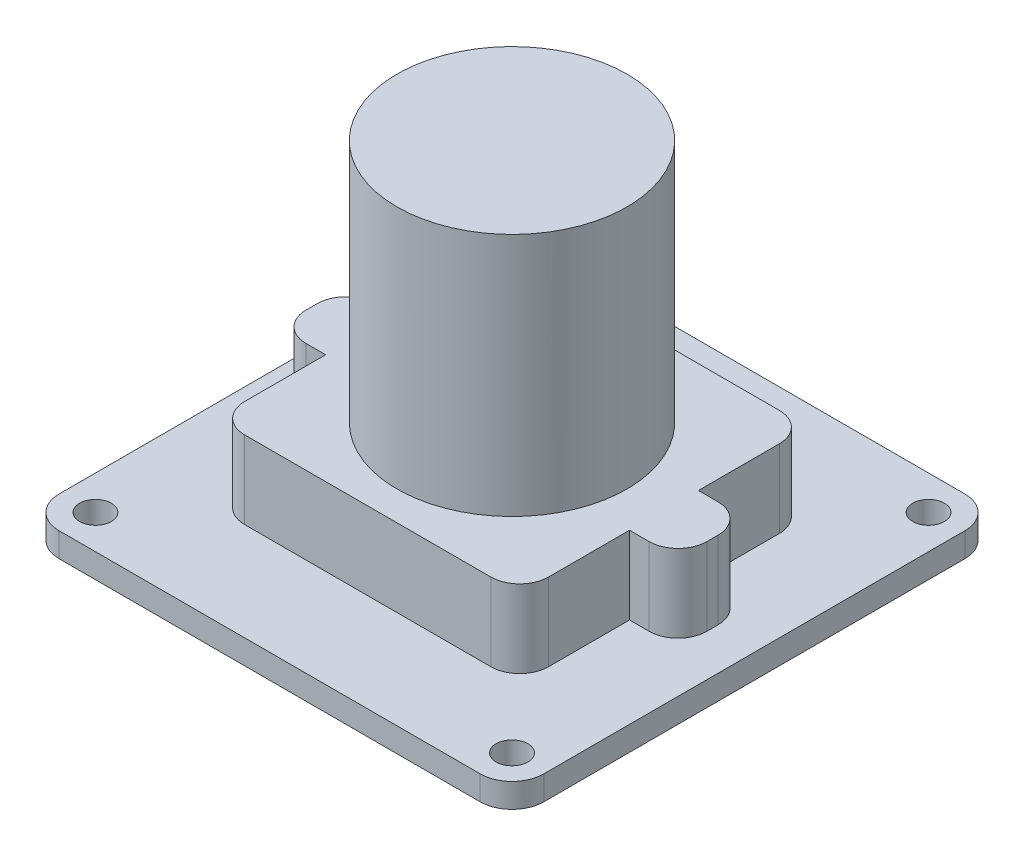
from build123d import *

# Parameters (mm, degrees)
SKETCH1_W           = 32
SKETCH1_H           = 32
SKETCH1_R           = 1.04775
BOSS_EXTRUDE1_DEPTH = 1.6002
BOSS_EXTRUDE2_DEPTH = 5.1308
FILLET1_R           = 2.1
FILLET2_R           = 1.905
SKETCH3_R           = 7.5946
BOSS_EXTRUDE3_DEPTH = 16.129


with BuildPart() as part:
    # Sketch1 → Boss-Extrude1 (new body)
    with BuildSketch(Plane(origin=(0, 0, 0), x_dir=(1, 0, 0), z_dir=(0, 1, 0))):
        Rectangle(SKETCH1_W, SKETCH1_H)
        with Locations(Location((13.7500106, 13.7500106, 0), (0, 0, 270))):
            Circle(SKETCH1_R, mode=Mode.SUBTRACT)
        with Locations(Location((-13.7500106, 13.7500106, 0), (0, 0, 270))):
            Circle(SKETCH1_R, mode=Mode.SUBTRACT)
        with Locations(Location((-13.75, -13.7500106, 0), (0, 0, 270))):
            Circle(SKETCH1_R, mode=Mode.SUBTRACT)
        with Locations(Location((13.7500106, -13.7500106, 0), (0, 0, 270))):
            Circle(SKETCH1_R, mode=Mode.SUBTRACT)
    extrude(amount=BOSS_EXTRUDE1_DEPTH)

    # Sketch2 → Boss-Extrude2 (add)
    with BuildSketch(Plane(origin=(0, 1.6002, 0), x_dir=(1, 0, 0), z_dir=(0, 1, 0))):
        Polygon((-10.033, 9.525), (10.033, 9.525), (10.033, 2.2733), (13.2334, 2.2733), (13.2334, -2.2733), (10.033, -2.2733), (10.033, -9.525), (-10.033, -9.525), (-10.033, -2.2733), (-13.2334, -2.2733), (-13.2334, 2.2733), (-10.033, 2.2733), align=None)
    extrude(amount=BOSS_EXTRUDE2_DEPTH)

    # Fillet1
    fillet1_edges = [part.edges().sort_by_distance(p)[0] for p in [
        (-16, 0.8001, -16),
        (16, 0.8001, -16),
        (16, 0.8001, 16),
        (-16, 0.8001, 16),
    ]]
    fillet(fillet1_edges, radius=FILLET1_R)

    # Fillet2
    fillet2_edges = [part.edges().sort_by_distance(p)[0] for p in [
        (-10.033, 4.1656, -9.525),
        (-13.2334, 4.1656, -2.2733),
        (-13.2334, 4.1656, 2.2733),
        (-10.033, 4.1656, 9.525),
        (10.033, 4.1656, 9.525),
        (13.2334, 4.1656, 2.2733),
        (13.2334, 4.1656, -2.2733),
        (10.033, 4.1656, -9.525),
    ]]
    fillet(fillet2_edges, radius=FILLET2_R)

    # Sketch3 → Boss-Extrude3 (add)
    with BuildSketch(Plane(origin=(0, 6.731, 0), x_dir=(1, 0, 0), z_dir=(0, 1, 0))):
        with Locations(Location((0, 0, 0), (0, 0, 90))):
            Circle(SKETCH3_R)
    extrude(amount=BOSS_EXTRUDE3_DEPTH)


solid = part.part
